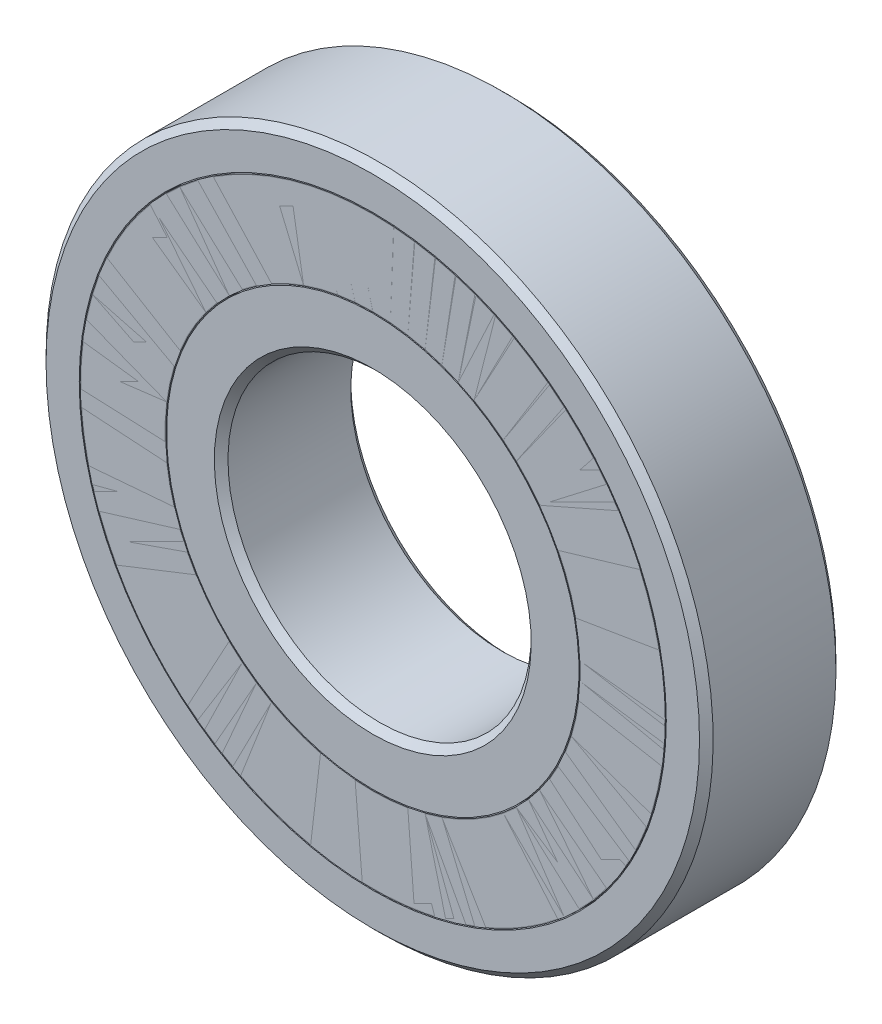
from build123d import *

# Parameters (mm, degrees)
SKETCH7_R           = 15.3162
SKETCH7_R_2         = 10.8458
BOSS_EXTRUDE2_DEPTH = 7.14375
FILLET1_R           = 0.03175


with BuildPart() as part:
    # Sketch3 → Revolve1 (revolve)
    with BuildSketch(Plane(origin=(0, 0, 0), x_dir=(0, 0, -1), z_dir=(1, 0, 0)), mode=Mode.PRIVATE) as revolve1_sk:
        with BuildLine():
            Line((3.2146875, 17.4625), (3.571875, 17.1053125))
            Line((3.571875, 17.1053125), (3.571875, 15.367))
            Line((3.571875, 15.367), (1.5875, 15.367))
            ThreePointArc((1.5875, 15.367), (0, 15.80371475), (-1.5875, 15.367))
            Line((-1.5875, 15.367), (-3.571875, 15.367))
            Line((-3.571875, 15.367), (-3.571875, 17.1053125))
            Line((-3.571875, 17.1053125), (-3.2146875, 17.4625))
            Line((-3.2146875, 17.4625), (3.2146875, 17.4625))
        make_face()
    revolve(revolve1_sk.sketch.rotate(Axis((0, 0, 3.571875), (0, 0, -1)), 180), axis=Axis((0, 0, 3.571875), (0, 0, -1)))


with BuildPart() as body_2:
    # Sketch4 → Revolve2 (revolve)
    with BuildSketch(Plane(origin=(0, 0, 0), x_dir=(0, 0, -1), z_dir=(1, 0, 0)), mode=Mode.PRIVATE) as revolve2_sk:
        with BuildLine():
            Line((-3.2146875, 7.9375), (-3.571875, 8.2946875))
            Line((-3.571875, 8.2946875), (-3.571875, 10.795))
            Line((-3.571875, 10.795), (-1.5875, 10.795))
            ThreePointArc((-1.5875, 10.795), (0, 10.35828525), (1.5875, 10.795))
            Line((1.5875, 10.795), (3.571875, 10.795))
            Line((3.571875, 10.795), (3.571875, 8.2946875))
            Line((3.571875, 8.2946875), (3.2146875, 7.9375))
            Line((3.2146875, 7.9375), (-3.2146875, 7.9375))
        make_face()
    revolve(revolve2_sk.sketch.rotate(Axis((0, 0, 3.571875), (0, 0, -1)), 180), axis=Axis((0, 0, 3.571875), (0, 0, -1)))


with BuildPart() as body_3:
    # Sketch7 → Boss-Extrude2 (new body)
    with BuildSketch(Plane(origin=(0, 12.7, -3.571875), x_dir=(-1, 0, 0), z_dir=(0, 0, -1))):
        with Locations(Location((0, -12.7, 0), (0, 0, 90))):
            Circle(SKETCH7_R)
        with Locations(Location((0, -12.7, 0), (0, 0, 90))):
            Circle(SKETCH7_R_2, mode=Mode.SUBTRACT)
    extrude(amount=-BOSS_EXTRUDE2_DEPTH)

    # Fillet1
    fillet1_edges = [body_3.edges().sort_by_distance(p)[0] for p in [
        (0, -15.3162, 3.571875),
        (0, -10.8458, 3.571875),
    ]]
    fillet(fillet1_edges, radius=FILLET1_R)


with BuildPart() as body_4:
    # Mirror1: mirrored copy
    add(body_3.part.mirror(Plane.XY))


solid = Compound([part.part, body_2.part, body_3.part, body_4.part])
